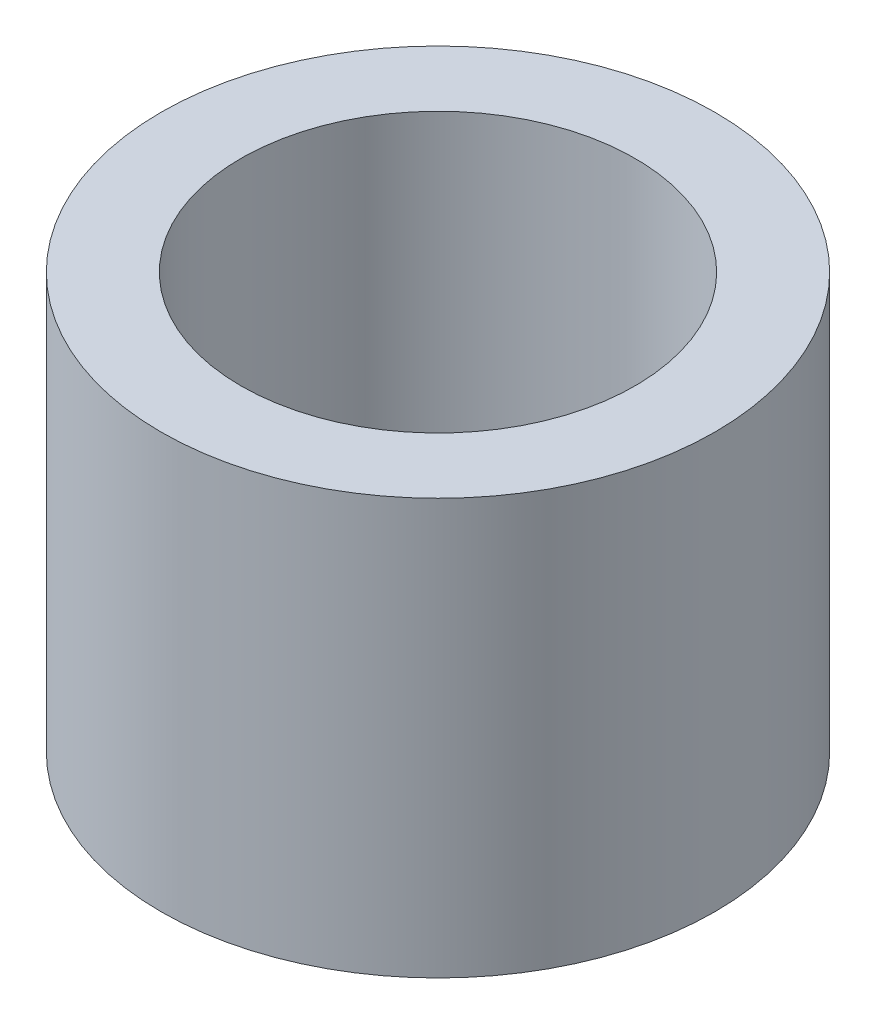
from build123d import *

# Parameters (mm, degrees)
CROQUIS1_R              = 50
CROQUIS1_R_2            = 35.575
SALIENTE_EXTRUIR3_DEPTH = 75


with BuildPart() as part:
    # Croquis1 → Saliente-Extruir3 (new body)
    with BuildSketch(Plane(origin=(0, 0, 0), x_dir=(1, 0, 0), z_dir=(0, 1, 0))):
        with Locations(Location((0, 0, 0), (0, 0, 270))):
            Circle(CROQUIS1_R)
        with Locations(Location((0, 0, 0), (0, 0, 270))):
            Circle(CROQUIS1_R_2, mode=Mode.SUBTRACT)
    extrude(amount=SALIENTE_EXTRUIR3_DEPTH)


solid = part.part
